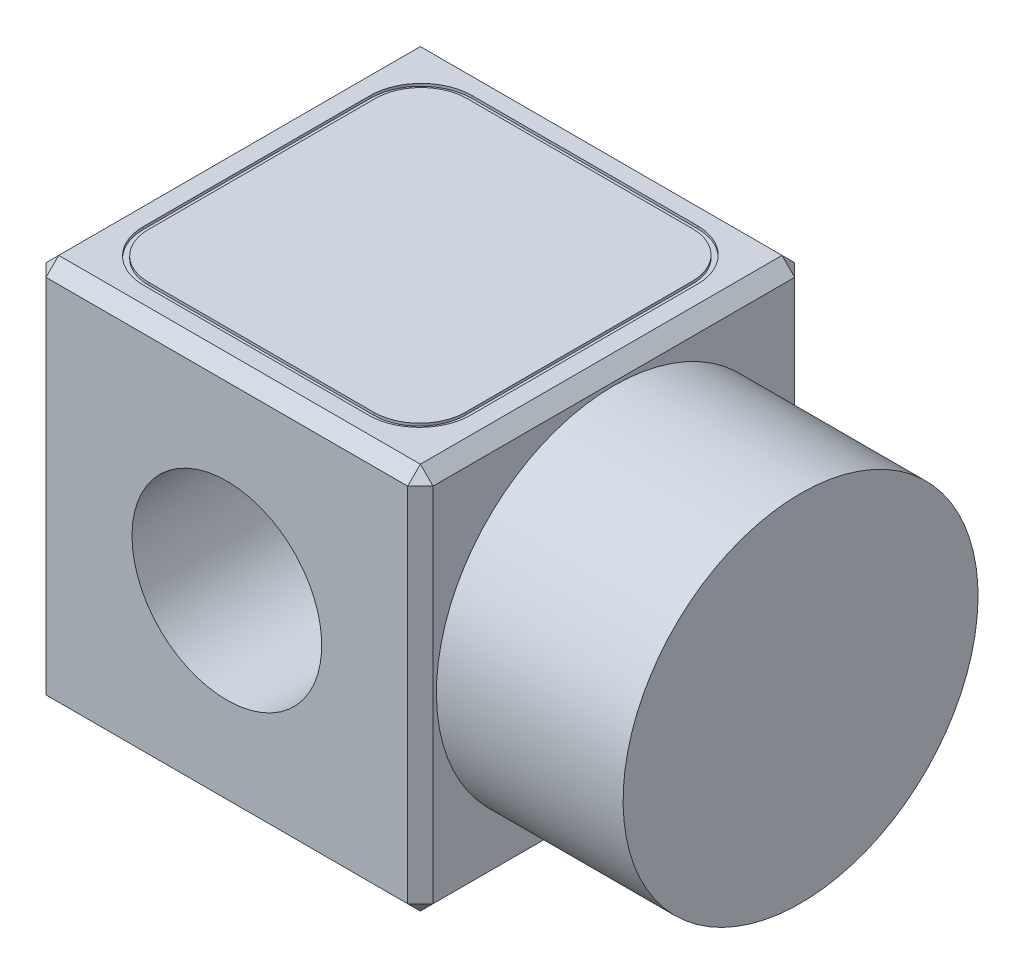
from build123d import *

# Parameters (mm, degrees)
SKETCH1_W           = 76.33
SKETCH1_H           = 76.33
BOSS_EXTRUDE1_DEPTH = 76.33
SKETCH2_R           = 35
BOSS_EXTRUDE2_DEPTH = 36.82
CHAMFER1_SIZE       = 2.5
CUT_EXTRUDE1_REACH  = 1889.491
CUT_EXTRUDE2_DEPTH  = 0.5


with BuildPart() as part:
    # Sketch1 → Boss-Extrude1 (new body)
    with BuildSketch(Plane.ZY.offset(-1848.740517551)):
        Rectangle(SKETCH1_W, SKETCH1_H)
    extrude(amount=BOSS_EXTRUDE1_DEPTH)

    # Sketch2 → Boss-Extrude2 (add)
    with BuildSketch(Plane(origin=(1848.740517551, 0, 0), x_dir=(0, 0, -1), z_dir=(1, 0, 0))):
        with Locations(Location((0, 0, 0), (0, 0, 90))):
            Circle(SKETCH2_R)
    extrude(amount=BOSS_EXTRUDE2_DEPTH)

    # Chamfer1
    chamfer1_edges = [part.edges().sort_by_distance(p)[0] for p in [
        (1772.410517551, -38.165, 0),
        (1772.410517551, 0, -38.165),
        (1772.410517551, 38.165, 0),
        (1848.740517551, 0, -38.165),
        (1848.740517551, -38.165, 0),
        (1848.740517551, 0, 38.165),
        (1848.740517551, 38.165, 0),
        (1772.410517551, 0, 38.165),
        (1810.575517551, 38.165, -38.165),
        (1810.575517551, -38.165, -38.165),
        (1810.575517551, -38.165, 38.165),
        (1810.575517551, 38.165, 38.165),
    ]]
    chamfer(chamfer1_edges, length=CHAMFER1_SIZE)

    # Sketch3 → Cut-Extrude1 (cut, up to next)
    with BuildSketch(Plane(origin=(0, 0, -38.165), x_dir=(-1, 0, 0), z_dir=(0, 0, -1)), mode=Mode.PRIVATE) as cut_extrude1_sk1:
        with BuildLine():
            ThreePointArc((-1791.865517551, 0), (-1797.345549675, 13.229967876), (-1810.575517551, 18.71))
            Line((-1810.575517551, 18.71), (-1810.575517551, -18.71))
            ThreePointArc((-1810.575517551, -18.71), (-1797.345549675, -13.229967876), (-1791.865517551, 0))
        make_face()
    cut_extrude1_tool1 = extrude(cut_extrude1_sk1.sketch, amount=-CUT_EXTRUDE1_REACH, mode=Mode.PRIVATE) & part.part
    # Sketch3 → Cut-Extrude1 (cut, up to next)
    with BuildSketch(Plane(origin=(0, 0, -38.165), x_dir=(-1, 0, 0), z_dir=(0, 0, -1)), mode=Mode.PRIVATE) as cut_extrude1_sk2:
        with BuildLine():
            Line((-1810.575517551, -18.71), (-1810.575517551, 18.71))
            ThreePointArc((-1810.575517551, 18.71), (-1829.285517551, 0), (-1810.575517551, -18.71))
        make_face()
    cut_extrude1_tool2 = extrude(cut_extrude1_sk2.sketch, amount=-CUT_EXTRUDE1_REACH, mode=Mode.PRIVATE) & part.part
    # Sketch3 → Cut-Extrude1 (cut, up to next)
    with BuildSketch(Plane(origin=(0, 0, -38.165), x_dir=(-1, 0, 0), z_dir=(0, 0, -1)), mode=Mode.PRIVATE) as cut_extrude1_sk3:
        with BuildLine():
            ThreePointArc((-1791.865517551, 0), (-1797.345549675, 13.229967876), (-1810.575517551, 18.71))
            Line((-1810.575517551, 18.71), (-1810.575517551, -18.71))
            ThreePointArc((-1810.575517551, -18.71), (-1797.345549675, -13.229967876), (-1791.865517551, 0))
        make_face()
    cut_extrude1_tool3 = extrude(cut_extrude1_sk3.sketch, amount=-CUT_EXTRUDE1_REACH, mode=Mode.PRIVATE) & part.part
    # Sketch3 → Cut-Extrude1 (cut, up to next)
    with BuildSketch(Plane(origin=(0, 0, -38.165), x_dir=(-1, 0, 0), z_dir=(0, 0, -1)), mode=Mode.PRIVATE) as cut_extrude1_sk4:
        with BuildLine():
            Line((-1810.575517551, -18.71), (-1810.575517551, 18.71))
            ThreePointArc((-1810.575517551, 18.71), (-1829.285517551, 0), (-1810.575517551, -18.71))
        make_face()
    cut_extrude1_tool4 = extrude(cut_extrude1_sk4.sketch, amount=-CUT_EXTRUDE1_REACH, mode=Mode.PRIVATE) & part.part
    add(cut_extrude1_tool1.solids().sort_by_distance((1802.634747, 0, -38.165))[0], mode=Mode.SUBTRACT)
    add(cut_extrude1_tool2.solids().sort_by_distance((1818.516288, 0, -38.165))[0], mode=Mode.SUBTRACT)
    add(cut_extrude1_tool3.solids().sort_by_distance((1802.634747, 0, -38.165))[0], mode=Mode.SUBTRACT)
    add(cut_extrude1_tool4.solids().sort_by_distance((1818.516288, 0, -38.165))[0], mode=Mode.SUBTRACT)

    # Sketch5 → Cut-Extrude2 (cut)
    with BuildSketch(Plane(origin=(0, 38.165, 0), x_dir=(1, 0, 0), z_dir=(0, 1, 0))):
        with BuildLine():
            Line((1788.358917551, -32.3946), (1832.792217551, -32.3946))
            add(Edge.make_bspline(
                [(1832.792217551, -32.3946), (1833.466855861, -32.3946), (1834.834608919, -32.253703608), (1837.339344692, -31.462150857), (1840.043615022, -29.624585418), (1841.881171353, -26.92029094), (1842.672721425, -24.415524634), (1842.813617551, -23.047748692), (1842.813617551, -22.3731)],
                knots=[0.555555556, 0.555555556, 0.555555556, 0.555555556, 0.569444444, 0.583333333, 0.611111111, 0.638888889, 0.652777778, 0.666666667, 0.666666667, 0.666666667, 0.666666667], degree=3))
            Line((1842.813617551, -22.3731), (1842.813617551, 22.373))
            add(Edge.make_bspline(
                [(1842.813617551, 22.373), (1842.813617551, 23.047629093), (1842.672720901, 24.415360154), (1841.881169744, 26.92007933), (1840.043614741, 29.624353237), (1837.339347144, 31.46193401), (1834.834610984, 32.25350014), (1833.466856595, 32.3944), (1832.792217551, 32.3944)],
                knots=[0.777777778, 0.777777778, 0.777777778, 0.777777778, 0.805555556, 0.833333333, 0.888888889, 0.944444444, 0.972222222, 1, 1, 1, 1], degree=3))
            Line((1832.792217551, 32.3944), (1788.358917551, 32.3944))
            add(Edge.make_bspline(
                [(1788.358917551, 32.3944), (1787.684278508, 32.3944), (1786.316524118, 32.25350014), (1783.811787958, 31.46193401), (1781.107520362, 29.624353237), (1779.269965358, 26.92007933), (1778.478414202, 24.415360154), (1778.337517551, 23.047629093), (1778.337517551, 22.373)],
                knots=[0.111111111, 0.111111111, 0.111111111, 0.111111111, 0.125, 0.138888889, 0.166666667, 0.194444444, 0.208333333, 0.222222222, 0.222222222, 0.222222222, 0.222222222], degree=3))
            Line((1778.337517551, 22.373), (1778.337517551, -22.3731))
            add(Edge.make_bspline(
                [(1778.337517551, -22.3731), (1778.337517551, -23.047748692), (1778.478413677, -24.415524634), (1779.269963749, -26.92029094), (1781.107520081, -29.624585418), (1783.81179041, -31.462150857), (1786.316526183, -32.253703608), (1787.684279242, -32.3946), (1788.358917551, -32.3946)],
                knots=[0.333333333, 0.333333333, 0.333333333, 0.333333333, 0.347222222, 0.361111111, 0.388888889, 0.416666667, 0.430555556, 0.444444444, 0.444444444, 0.444444444, 0.444444444], degree=3))
        make_face()
        with BuildLine():
            Line((1788.358917551, -31.3946), (1832.792217551, -31.3946))
            add(Edge.make_bspline(
                [(1832.792217551, -31.3946), (1833.399248628, -31.3946), (1834.630365029, -31.267771469), (1836.881569909, -30.556358134), (1839.319622864, -28.900598899), (1840.975375901, -26.462522118), (1841.686788747, -24.211284373), (1841.813617551, -22.980142574), (1841.813617551, -22.3731)],
                knots=[0.555555556, 0.555555556, 0.555555556, 0.555555556, 0.569444444, 0.583333333, 0.611111111, 0.638888889, 0.652777778, 0.666666667, 0.666666667, 0.666666667, 0.666666667], degree=3))
            Line((1841.813617551, -22.3731), (1841.813617551, 22.373))
            add(Edge.make_bspline(
                [(1841.813617551, 22.373), (1841.813617551, 22.980021237), (1841.686789271, 24.211113504), (1840.975377513, 26.462304848), (1839.319623121, 28.900367756), (1836.881567526, 30.556143835), (1834.630362845, 31.267568666), (1833.399248157, 31.3944), (1832.792217551, 31.3944)],
                knots=[0.777777778, 0.777777778, 0.777777778, 0.777777778, 0.805555556, 0.833333333, 0.888888889, 0.944444444, 0.972222222, 1, 1, 1, 1], degree=3))
            Line((1832.792217551, 31.3944), (1788.358917551, 31.3944))
            add(Edge.make_bspline(
                [(1788.358917551, 31.3944), (1787.751886946, 31.3944), (1786.520772257, 31.267568666), (1784.269567577, 30.556143835), (1781.831511982, 28.900367756), (1780.175757589, 26.462304848), (1779.464345832, 24.211113504), (1779.337517551, 22.980021237), (1779.337517551, 22.373)],
                knots=[0.111111111, 0.111111111, 0.111111111, 0.111111111, 0.125, 0.138888889, 0.166666667, 0.194444444, 0.208333333, 0.222222222, 0.222222222, 0.222222222, 0.222222222], degree=3))
            Line((1779.337517551, 22.373), (1779.337517551, -22.3731))
            add(Edge.make_bspline(
                [(1779.337517551, -22.3731), (1779.337517551, -22.980142574), (1779.464346356, -24.211284373), (1780.175759201, -26.462522118), (1781.831512239, -28.900598899), (1784.269565194, -30.556358134), (1786.520770074, -31.267771469), (1787.751886474, -31.3946), (1788.358917551, -31.3946)],
                knots=[0.333333333, 0.333333333, 0.333333333, 0.333333333, 0.347222222, 0.361111111, 0.388888889, 0.416666667, 0.430555556, 0.444444444, 0.444444444, 0.444444444, 0.444444444], degree=3))
        make_face(mode=Mode.SUBTRACT)
    extrude(amount=-CUT_EXTRUDE2_DEPTH, mode=Mode.SUBTRACT)


solid = part.part
